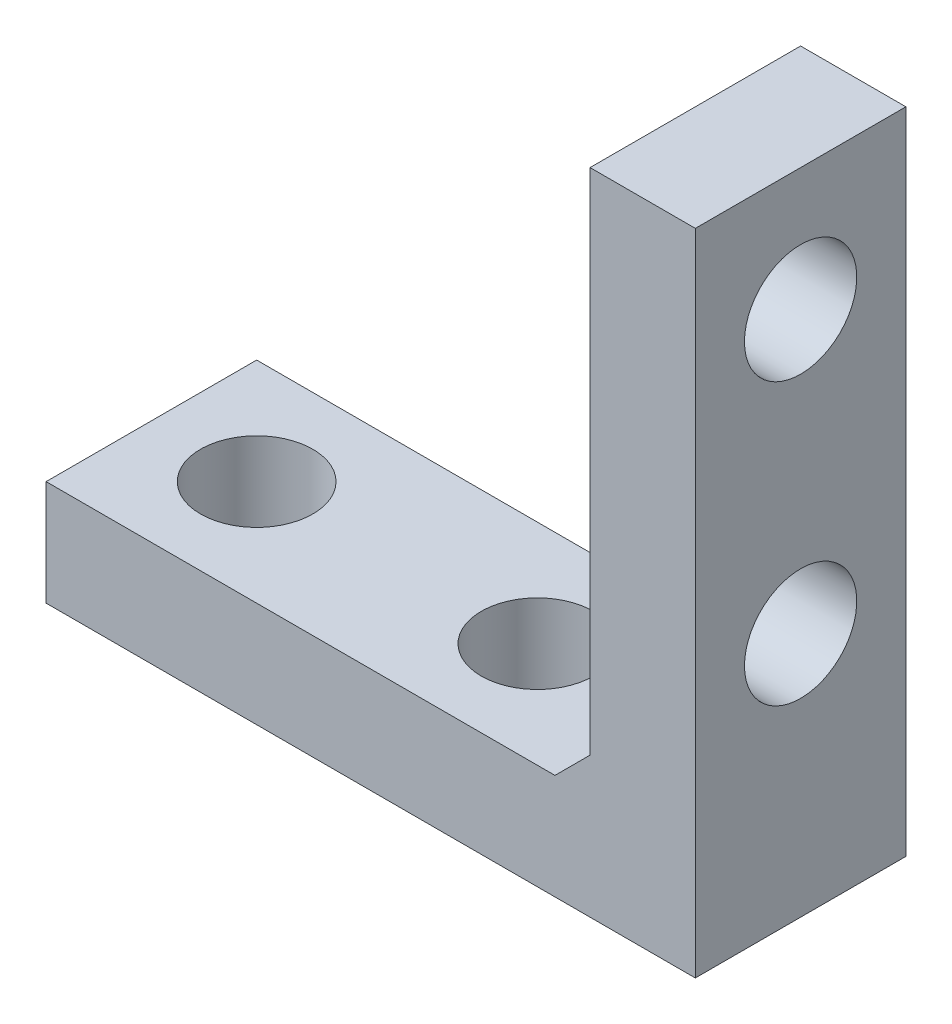
from build123d import *

# Parameters (mm, degrees)
SKETCH1_W           = 18.5
SKETCH1_H           = 6
SKETCH1_R           = 1.6
BOSS_EXTRUDE1_DEPTH = 3
SKETCH2_W           = 3
SKETCH2_H           = 6
BOSS_EXTRUDE2_DEPTH = 15.5
SKETCH3_R           = 1.6
CUT_EXTRUDE1_DEPTH  = 25.320773014
BOSS_EXTRUDE3_DEPTH = 6


with BuildPart() as part:
    # Sketch1 → Boss-Extrude1 (new body)
    with BuildSketch(Plane(origin=(0, 0, 0), x_dir=(1, 0, 0), z_dir=(0, 1, 0))):
        Rectangle(SKETCH1_W, SKETCH1_H)
        with Locations(Location((-6.25, 0, 0), (0, 0, 270))):
            Circle(SKETCH1_R, mode=Mode.SUBTRACT)
        with Locations(Location((1.75, 0, 0), (0, 0, 270))):
            Circle(SKETCH1_R, mode=Mode.SUBTRACT)
    extrude(amount=BOSS_EXTRUDE1_DEPTH)

    # Sketch2 → Boss-Extrude2 (add)
    with BuildSketch(Plane(origin=(0, 3, 0), x_dir=(1, 0, 0), z_dir=(0, 1, 0))):
        with Locations((7.75, 0)):
            Rectangle(SKETCH2_W, SKETCH2_H)
    extrude(amount=BOSS_EXTRUDE2_DEPTH)

    # Sketch3 → Cut-Extrude1 (cut, through all)
    with BuildSketch(Plane.ZY.offset(-6.25)):
        with Locations((0, 7)):
            Circle(SKETCH3_R)
        with Locations((0, 15)):
            Circle(SKETCH3_R)
    extrude(amount=-CUT_EXTRUDE1_DEPTH, mode=Mode.SUBTRACT)

    # Sketch5 → Boss-Extrude3 (add)
    with BuildSketch(Plane(origin=(6.25, 3, 3), x_dir=(1, 0, 0), z_dir=(0, 0, 1))):
        Polygon((-1, 0), (0, 1), (0, 0), align=None)
    extrude(amount=-BOSS_EXTRUDE3_DEPTH)


solid = part.part
